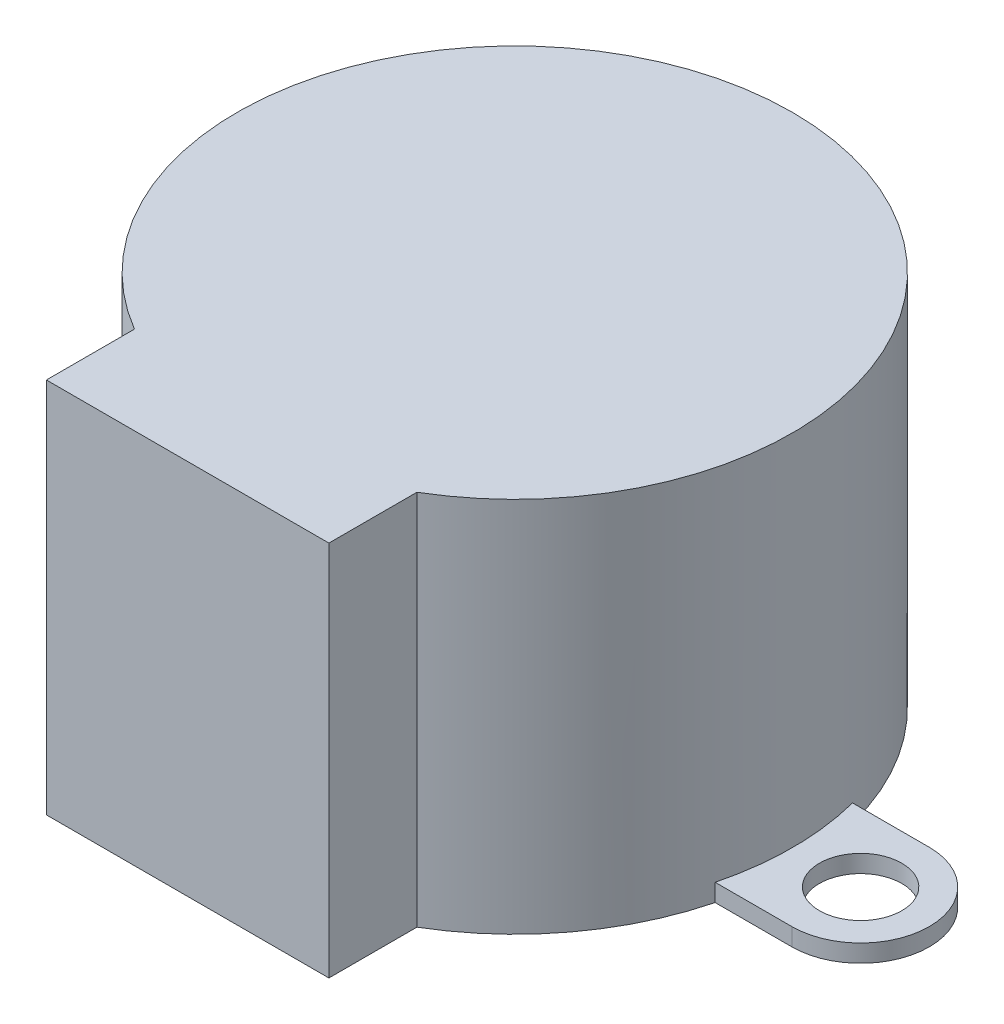
from build123d import *
from build123d.topology import SkipClean

# Parameters (mm, degrees)
EXTRUDE_1_DEPTH = 19.05
SKETCH_2_R      = 2.0828
EXTRUDE_2_DEPTH = 0.889
SKETCH_3_R      = 4.635
EXTRUDE_3_DEPTH = 1.524
SKETCH_4_R      = 2.4892
EXTRUDE_4_DEPTH = 0.8001
EXTRUDE_5_DEPTH = 6.1976


with BuildPart() as part:
    # 스케치1 → 보스-돌출1 (new body)
    with BuildSketch(Plane(origin=(0, 0, 0), x_dir=(1, 0, 0), z_dir=(0, 1, 0))):
        with BuildLine():
            Line((-7.14375, -16.545), (7.14375, -16.545))
            Line((7.14375, -16.545), (7.14375, -12.092512598))
            ThreePointArc((7.14375, -12.092512598), (0, 14.045), (-7.14375, -12.092512598))
            Line((-7.14375, -12.092512598), (-7.14375, -16.545))
        make_face()
    extrude(amount=EXTRUDE_1_DEPTH)

    # 스케치2 → 보스-돌출2 (add)
    # profile 1 of 2: a face of its own
    with BuildSketch(Plane.XZ):
        with BuildLine():
            Line((-17.49, 3.475), (-13.608320984, 3.475))
            ThreePointArc((-13.608320984, 3.475), (-14.045, 0), (-13.608320984, -3.475))
            Line((-13.608320984, -3.475), (-17.49, -3.475))
            ThreePointArc((-17.49, -3.475), (-20.965, 0), (-17.49, 3.475))
        make_face()
        with Locations(Location((-17.49, 0, 0), (0, 0, 90))):
            Circle(SKETCH_2_R, mode=Mode.SUBTRACT)
    # profile 2 of 2: a face of its own
    with BuildSketch(Plane.XZ):
        with BuildLine():
            Line((17.49, 3.475), (13.608320984, 3.475))
            ThreePointArc((13.608320984, 3.475), (14.045, 0), (13.608320984, -3.475))
            Line((13.608320984, -3.475), (17.49, -3.475))
            ThreePointArc((17.49, -3.475), (20.965, 0), (17.49, 3.475))
        make_face()
        with Locations(Location((17.49, 0, 0), (0, 0, 270))):
            Circle(SKETCH_2_R, mode=Mode.SUBTRACT)
    extrude(amount=-EXTRUDE_2_DEPTH)

    # 스케치3 → 보스-돌출3 (add)
    with BuildSketch(Plane.XZ):
        with Locations(Location((0, -8.03, 0), (0, 0, 90))):
            Circle(SKETCH_3_R)
    extrude(amount=EXTRUDE_3_DEPTH)

    # 스케치4 → 보스-돌출4 (add)
    with BuildSketch(Plane.XZ.offset(1.524)):
        with Locations(Location((0, -8.03, 0), (0, 0, 270))):
            Circle(SKETCH_4_R)
    extrude(amount=EXTRUDE_4_DEPTH)

    # 스케치5 → 보스-돌출5 (add)
    with SkipClean():  # the faces are left unmerged after this step: merging them gives an invalid solid
        with BuildSketch(Plane.XZ.offset(2.3241)):
            with BuildLine():
                Line((2.001761334, -9.50955), (-2.001761334, -9.50955))
                ThreePointArc((-2.001761334, -9.50955), (-2.4892, -8.03), (-2.001761334, -6.55045))
                Line((-2.001761334, -6.55045), (2.001761334, -6.55045))
                ThreePointArc((2.001761334, -6.55045), (2.4892, -8.03), (2.001761334, -9.50955))
            make_face()
        extrude(amount=EXTRUDE_5_DEPTH)


solid = part.part
